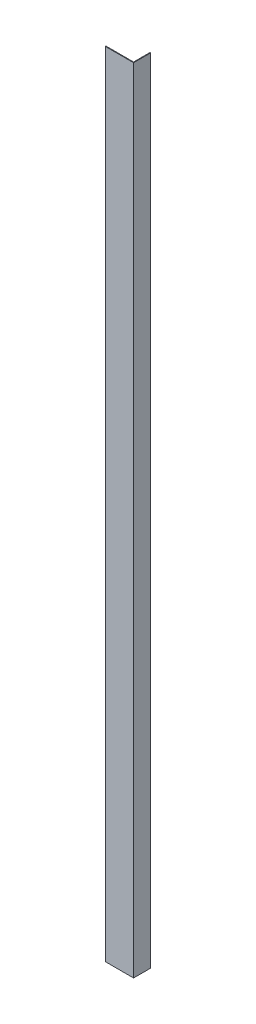
from build123d import *

# Parameters (mm, degrees)
STORE_SOVE_SOL_1_START = 120
STORE_SOVE_SOL_1_DEPTH = 1850


with BuildPart() as part:
    # Sketch1 → STORE_sove_sol_1 (new body)
    with BuildSketch(Plane(origin=(0, 0, 0), x_dir=(1, 0, 0), z_dir=(0, 1, 0)).offset(STORE_SOVE_SOL_1_START)):
        Polygon((0, -40), (0, -38.5), (64.5, -38.5), (64.5, 0), (66, 0), (66, -40), align=None)
    extrude(amount=STORE_SOVE_SOL_1_DEPTH)


solid = part.part
